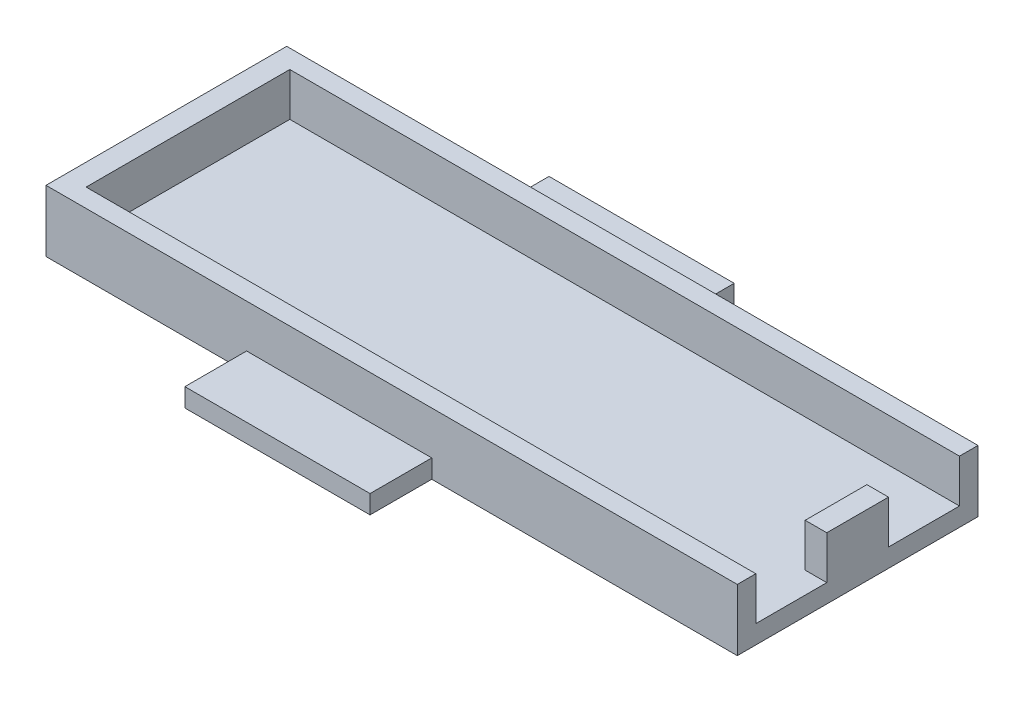
from build123d import *

# Parameters (mm, degrees)
SKETCH1_W           = 112
SKETCH1_H           = 39
SKETCH1_W_2         = 105
SKETCH1_H_2         = 33
BOSS_EXTRUDE1_DEPTH = 10
SKETCH2_W           = 105
SKETCH2_H           = 33
BOSS_EXTRUDE2_DEPTH = 3
SKETCH3_W           = 11.5
SKETCH3_H           = 10.919197496
SKETCH3_H_2         = 11.051284563
CUT_EXTRUDE1_DEPTH  = 111.691011379
SKETCH4_W           = 30
SKETCH4_H           = 10
BOSS_EXTRUDE3_DEPTH = 3
SKETCH5_W           = 17
SKETCH5_H           = 3
BOSS_EXTRUDE4_DEPTH = 3


with BuildPart() as part:
    # Sketch1 → Boss-Extrude1 (new body)
    with BuildSketch(Plane(origin=(0, 0, 0), x_dir=(1, 0, 0), z_dir=(0, 1, 0))):
        Rectangle(SKETCH1_W, SKETCH1_H)
        Rectangle(SKETCH1_W_2, SKETCH1_H_2, mode=Mode.SUBTRACT)
    extrude(amount=BOSS_EXTRUDE1_DEPTH)

    # Sketch2 → Boss-Extrude2 (add)
    with BuildSketch(Plane(origin=(0, 0, 0), x_dir=(1, 0, 0), z_dir=(0, 1, 0))):
        Rectangle(SKETCH2_W, SKETCH2_H)
    extrude(amount=BOSS_EXTRUDE2_DEPTH)

    # Sketch3 → Cut-Extrude1 (cut, through all)
    with BuildSketch(Plane.ZY.offset(-52.5)):
        with Locations((-10.75, 8.459598748)):
            Rectangle(SKETCH3_W, SKETCH3_H)
        with Locations((10.75, 8.525642282)):
            Rectangle(SKETCH3_W, SKETCH3_H_2)
    extrude(amount=-CUT_EXTRUDE1_DEPTH, mode=Mode.SUBTRACT)

    # Sketch4 → Boss-Extrude3 (add)
    with BuildSketch(Plane(origin=(0, 0, 0), x_dir=(1, 0, 0), z_dir=(0, 1, 0))):
        with Locations((-8.5, 24.5)):
            Rectangle(SKETCH4_W, SKETCH4_H)
        with Locations((-8.5, -24.5)):
            Rectangle(SKETCH4_W, SKETCH4_H)
    extrude(amount=BOSS_EXTRUDE3_DEPTH)

    # Sketch5 → Boss-Extrude4 (add)
    with BuildSketch(Plane.XZ):
        with Locations((-8, 24.845915891)):
            Rectangle(SKETCH5_W, SKETCH5_H)
        with BuildLine():
            Line((-16.5, 26.345915891), (-16.5, 23.345915891))
            ThreePointArc((-16.5, 23.345915891), (-18, 24.845915891), (-16.5, 26.345915891))
        make_face()
        with BuildLine():
            ThreePointArc((0.5, 26.345915891), (2, 24.845915891), (0.5, 23.345915891))
            Line((0.5, 23.345915891), (0.5, 26.345915891))
        make_face()
    boss_extrude4 = extrude(amount=BOSS_EXTRUDE4_DEPTH)

    # Mirror1: Boss-Extrude4 across plane
    add(boss_extrude4.mirror(Plane.XY))


solid = part.part
